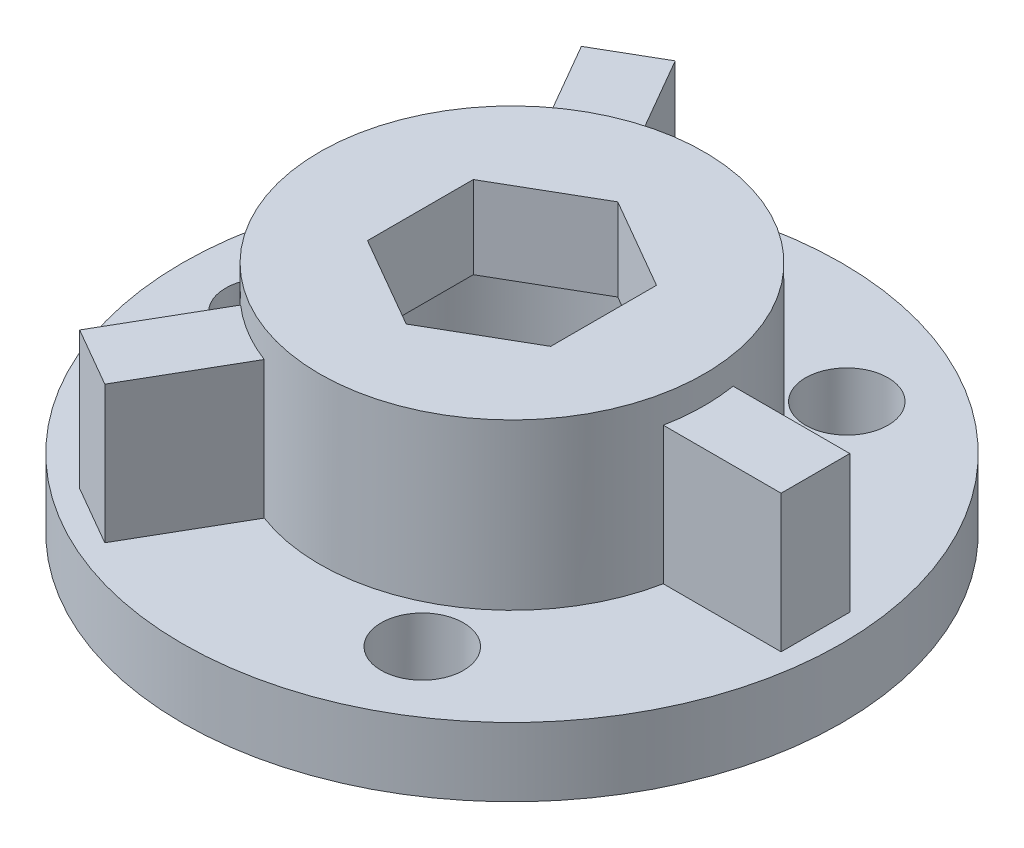
from build123d import *

# Parameters (mm, degrees)
SKETCH_1_R               = 12
EXTRUDE_1_DEPTH          = 2.5
SKETCH_2_R               = 5.7
CUT_EXTRUDE_1_DEPTH      = 2.5
SKETCH_3_R               = 7
EXTRUDE_2_DEPTH          = 6
CUT_EXTRUDE_3_DEPTH      = 19.980252896
CUT_EXTRUDE_START        = -3
SKETCH_6_R               = 5.7
CUT_EXTRUDE_4_DEPTH      = 3
SKETCH_12_R              = 1.5
CUT_EXTRUDE_7_DEPTH      = 8.5
PATTERN_CIRCULAR_3_COUNT = 3
SKETCH_16_W              = 4.841129394
SKETCH_16_H              = 2.5
EXTRUDE_5_DEPTH          = 5
PATTERN_CIRCULAR_4_COUNT = 3


with BuildPart() as part:
    # 草图1 → 凸台-拉伸1 (new body)
    with BuildSketch(Plane(origin=(0, 0, 0), x_dir=(1, 0, 0), z_dir=(0, 1, 0))):
        Circle(SKETCH_1_R)
    extrude(amount=EXTRUDE_1_DEPTH)

    # 草图2 → 切除-拉伸1 (cut)
    with BuildSketch(Plane(origin=(0, 2.5, 0), x_dir=(1, 0, 0), z_dir=(0, 1, 0))):
        Circle(SKETCH_2_R)
    extrude(amount=-CUT_EXTRUDE_1_DEPTH, mode=Mode.SUBTRACT)

    # 草图3 → 凸台-拉伸2 (add)
    with BuildSketch(Plane(origin=(0, 2.5, 0), x_dir=(1, 0, 0), z_dir=(0, 1, 0))):
        Circle(SKETCH_3_R)
    extrude(amount=EXTRUDE_2_DEPTH)

    # 草图5 → 切除-拉伸3 (cut, through all)
    with BuildSketch(Plane(origin=(0, 8.5, 0), x_dir=(1, 0, 0), z_dir=(0, 1, 0))):
        Polygon((3.334197805, -1.925), (3.334197805, 1.925), (0, 3.85), (-3.334197805, 1.925), (-3.334197805, -1.925), (0, -3.85), align=None)
    extrude(amount=-CUT_EXTRUDE_3_DEPTH, mode=Mode.SUBTRACT)

    # 草图6 → 切除-拉伸4 (cut)
    with BuildSketch(Plane.XZ.offset(-2.5).offset(CUT_EXTRUDE_START)):
        Circle(SKETCH_6_R)
    extrude(amount=CUT_EXTRUDE_4_DEPTH, mode=Mode.SUBTRACT)

    # 草图12 → 切除-拉伸7 (cut)
    with BuildSketch(Plane(origin=(0, 0, 0), x_dir=(-1, 0, 0), z_dir=(0, -1, 0))):
        with Locations((-4.46, 7.724946602)):
            Circle(SKETCH_12_R)
    cut_extrude_7 = extrude(amount=-CUT_EXTRUDE_7_DEPTH, mode=Mode.SUBTRACT)

    # 阵列(圆周)3: 切除-拉伸7 ×3 about axis
    pattern_circular_3_axis = Axis((0, 8.5, 0), (0, -1, 0))
    for i in range(1, PATTERN_CIRCULAR_3_COUNT):
        add(cut_extrude_7.rotate(pattern_circular_3_axis, i * 360 / PATTERN_CIRCULAR_3_COUNT), mode=Mode.SUBTRACT)

    # 草图16 → 凸台-拉伸5 (add)
    with BuildSketch(Plane(origin=(0, 2.5, 0), x_dir=(1, 0, 0), z_dir=(0, 1, 0))):
        with Locations((8.734133088, -0.110223506)):
            Rectangle(SKETCH_16_W, SKETCH_16_H)
    extrude_5 = extrude(amount=EXTRUDE_5_DEPTH)

    # 阵列(圆周)4: 凸台-拉伸5 ×3 about axis
    pattern_circular_4_axis = Axis((0, 8.5, 0), (0, -1, 0))
    for i in range(1, PATTERN_CIRCULAR_4_COUNT):
        add(extrude_5.rotate(pattern_circular_4_axis, i * 360 / PATTERN_CIRCULAR_4_COUNT))


solid = part.part
